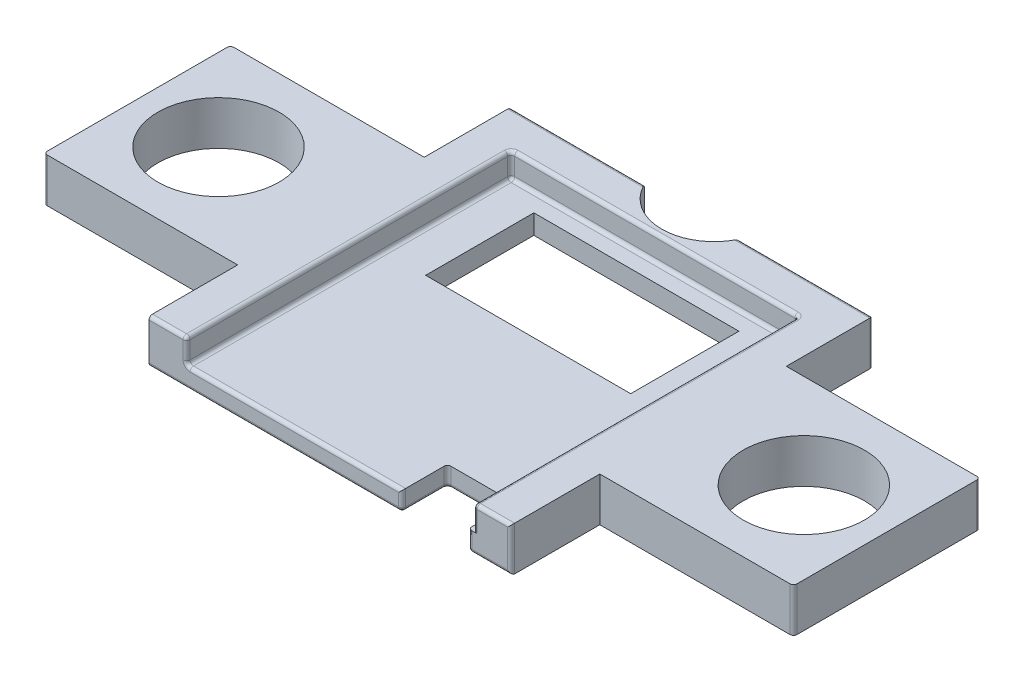
from build123d import *

# Parameters (mm, degrees)
SKETCH1_W           = 20.75
SKETCH1_H           = 20.75
SKETCH1_W_2         = 11.75
SKETCH1_H_2         = 6.2
BOSS_EXTRUDE1_DEPTH = 1.12
SKETCH2_W           = 2.15
SKETCH2_H           = 18.6
BOSS_EXTRUDE2_DEPTH = 1.4
CUT_EXTRUDE1_DEPTH  = 15.739106147
FILLET1_R           = 0.2
SKETCH5_R           = 3.475
BOSS_EXTRUDE3_DEPTH = 2.52
SKETCH6_R           = 3
CUT_EXTRUDE2_DEPTH  = 10


with BuildPart() as part:
    # Sketch1 → Boss-Extrude1 (new body)
    with BuildSketch(Plane(origin=(0, 0, 0), x_dir=(1, 0, 0), z_dir=(0, 1, 0))):
        Rectangle(SKETCH1_W, SKETCH1_H)
        with Locations((0, 4.075)):
            Rectangle(SKETCH1_W_2, SKETCH1_H_2, mode=Mode.SUBTRACT)
    extrude(amount=BOSS_EXTRUDE1_DEPTH)

    # Sketch2 → Boss-Extrude2 (add)
    with BuildSketch(Plane(origin=(0, 1.12, 0), x_dir=(1, 0, 0), z_dir=(0, 1, 0))):
        Polygon((10.375, 10.375), (-10.375, 10.375), (-10.375, 8.225), (-8.225, 8.225), (8.225, 8.225), (10.375, 8.225), align=None)
        with Locations((-9.3, -1.075)):
            Rectangle(SKETCH2_W, SKETCH2_H)
        with Locations((9.3, -1.075)):
            Rectangle(SKETCH2_W, SKETCH2_H)
    extrude(amount=BOSS_EXTRUDE2_DEPTH)

    # Sketch3 → Cut-Extrude1 (cut, through all)
    with BuildSketch(Plane(origin=(0, 1.12, 0), x_dir=(1, 0, 0), z_dir=(0, 1, 0))):
        with BuildLine():
            Line((7.925, -10.375), (4.128372784, -10.375))
            Line((4.128372784, -10.375), (4.128372784, -7.975))
            ThreePointArc((4.128372784, -7.975), (4.186951428, -7.833578644), (4.328372784, -7.775))
            Line((4.328372784, -7.775), (7.725, -7.775))
            ThreePointArc((7.725, -7.775), (7.866421356, -7.833578644), (7.925, -7.975))
            Line((7.925, -7.975), (7.925, -10.375))
        make_face()
    extrude(amount=-CUT_EXTRUDE1_DEPTH, mode=Mode.SUBTRACT)

    # Fillet1
    fillet1_edges = [part.edges().sort_by_distance(p)[0] for p in [
        (-2.048313608, 1.12, 10.375),
        (-8.225, 1.82, -8.225),
        (0, 1.12, -8.225),
        (-8.225, 2.52, 1.075),
        (-8.225, 1.82, 10.375),
        (-9.3, 2.52, 10.375),
        (0, 2.52, -8.225),
        (8.225, 2.52, 1.075),
        (0, 2.52, -10.375),
        (-8.225, 1.12, 1.075),
        (8.225, 1.82, -8.225),
        (9.3, 2.52, 10.375),
        (8.225, 1.82, 10.375),
        (-3.123313608, 0, 10.375),
        (0, 0, -10.375),
        (9.15, 0, 10.375),
        (7.925, 0, 9.175),
        (7.925, 0.56, 10.375),
        (4.128372784, 0, 9.175),
        (4.128372784, 0.56, 10.375),
        (4.186951428, 0, 7.833578644),
        (6.026686392, 0, 7.775),
        (7.866421356, 0, 7.833578644),
        (10.375, 1.26, 10.375),
        (-10.375, 1.26, -10.375),
        (10.375, 1.26, -10.375),
    ]]
    fillet(fillet1_edges, radius=FILLET1_R)

    # Sketch5 → Boss-Extrude3 (add)
    # profile 1 of 2: a face of its own
    with BuildSketch(Plane(origin=(0, 2.52, 0), x_dir=(1, 0, 0), z_dir=(0, 1, 0))):
        with BuildLine():
            Line((-10.375, 5.392486931), (-21.275499471, 5.392486931))
            ThreePointArc((-21.275499471, 5.392486931), (-21.416920828, 5.333908287), (-21.475499471, 5.192486931))
            Line((-21.475499471, 5.192486931), (-21.475499471, -5.096478262))
            ThreePointArc((-21.475499471, -5.096478262), (-21.416920828, -5.237899618), (-21.275499471, -5.296478262))
            Line((-21.275499471, -5.296478262), (-10.375, -5.296478262))
            Line((-10.375, -5.296478262), (-10.375, 5.392486931))
        make_face()
        with Locations(Location((-16.77, 0, 0), (0, 0, 270))):
            Circle(SKETCH5_R, mode=Mode.SUBTRACT)
    # profile 2 of 2: a face of its own
    with BuildSketch(Plane(origin=(0, 2.52, 0), x_dir=(1, 0, 0), z_dir=(0, 1, 0))):
        with BuildLine():
            Line((10.375, 5.392486931), (21.275499471, 5.392486931))
            ThreePointArc((21.275499471, 5.392486931), (21.416920828, 5.333908287), (21.475499471, 5.192486931))
            Line((21.475499471, 5.192486931), (21.475499471, -5.096478262))
            ThreePointArc((21.475499471, -5.096478262), (21.416920828, -5.237899618), (21.275499471, -5.296478262))
            Line((21.275499471, -5.296478262), (10.375, -5.296478262))
            Line((10.375, -5.296478262), (10.375, 5.392486931))
        make_face()
        with Locations(Location((16.77, 0, 0), (0, 0, 270))):
            Circle(SKETCH5_R, mode=Mode.SUBTRACT)
    extrude(amount=-BOSS_EXTRUDE3_DEPTH)

    # Sketch6 → Cut-Extrude2 (cut)
    with BuildSketch(Plane(origin=(0, 2.52, 0), x_dir=(1, 0, 0), z_dir=(0, 1, 0))):
        with Locations((0, 11.63)):
            Circle(SKETCH6_R)
    extrude(amount=-CUT_EXTRUDE2_DEPTH, mode=Mode.SUBTRACT)


solid = part.part
